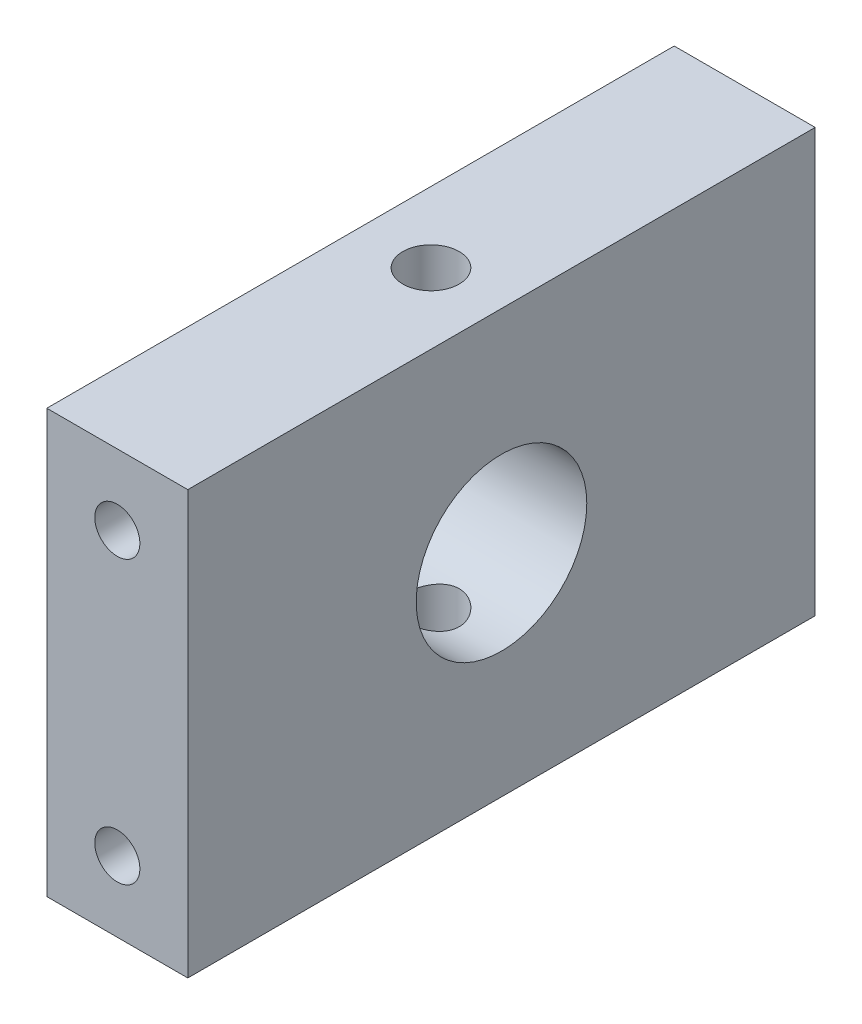
from build123d import *

# Parameters (mm, degrees)
SKETCH_1_W          = 44.5
SKETCH_1_H          = 30
SKETCH_1_R          = 6.05
EXTRUDE_1_DEPTH     = 10
SKETCH_2_R          = 1.6
CUT_EXTRUDE_1_DEPTH = 10
SKETCH_3_R          = 2
CUT_EXTRUDE_2_DEPTH = 39.66603807


with BuildPart() as part:
    # ｽｹｯﾁ1 → ﾎﾞｽ - 押し出し1 (new body)
    with BuildSketch(Plane(origin=(0, 0, 0), x_dir=(0, 0, -1), z_dir=(1, 0, 0))):
        Rectangle(SKETCH_1_W, SKETCH_1_H)
        Circle(SKETCH_1_R, mode=Mode.SUBTRACT)
    extrude(amount=EXTRUDE_1_DEPTH)

    # ｽｹｯﾁ2 → ｶｯﾄ - 押し出し1 (cut)
    with BuildSketch(Plane.XY.offset(22.25)):
        with Locations((5, 10)):
            Circle(SKETCH_2_R)
        with Locations(Location((5, -10, 0), (0, 0, 180))):
            Circle(SKETCH_2_R)
    cut_extrude_1 = extrude(amount=-CUT_EXTRUDE_1_DEPTH, mode=Mode.SUBTRACT)

    # ｽｹｯﾁ3 → ｶｯﾄ - 押し出し2 (cut, through all)
    with BuildSketch(Plane(origin=(0, 15, 0), x_dir=(1, 0, 0), z_dir=(0, 1, 0))):
        with Locations(Location((5, 0, 0), (0, 0, 270))):
            Circle(SKETCH_3_R)
    extrude(amount=-CUT_EXTRUDE_2_DEPTH, mode=Mode.SUBTRACT)

    # ﾐﾗｰ1: ｶｯﾄ - 押し出し1 across plane
    add(cut_extrude_1.mirror(Plane.XY), mode=Mode.SUBTRACT)


solid = part.part
